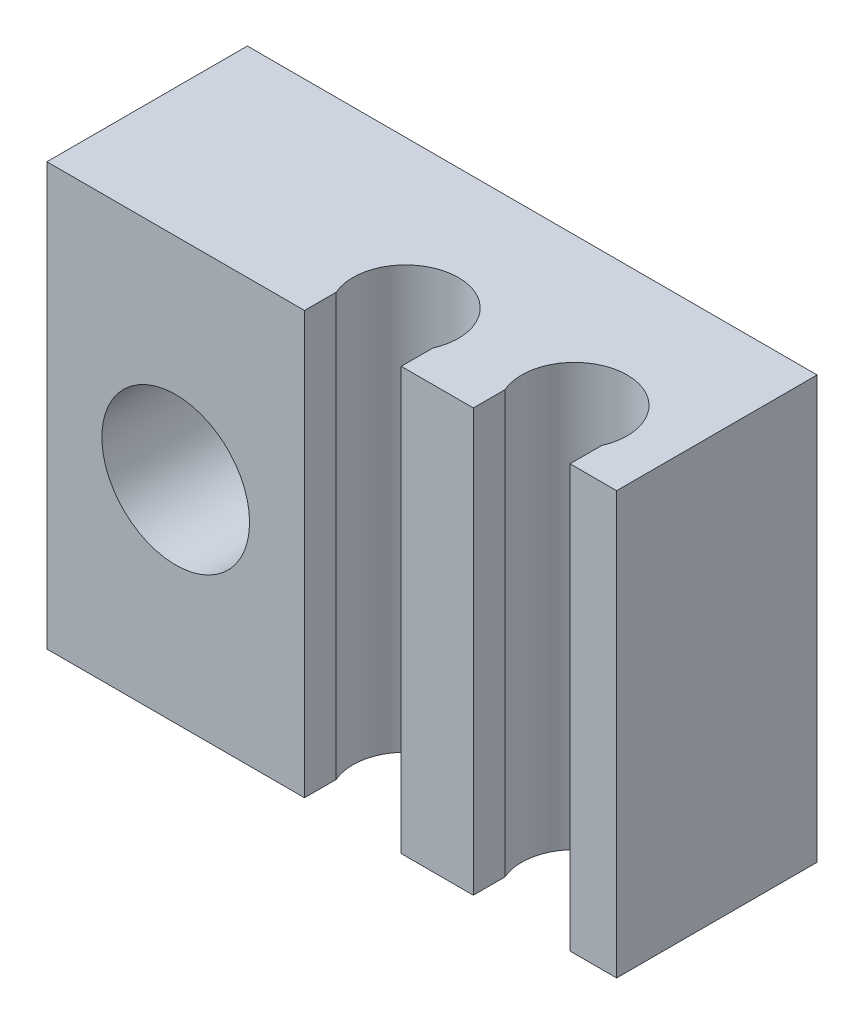
from build123d import *

# Parameters (mm, degrees)
BOSS_EXTRUDE1_DEPTH = 10
SKETCH4_R           = 1.75
CUT_EXTRUDE2_DEPTH  = 14.957524852


with BuildPart() as part:
    # Sketch1 → Boss-Extrude1 (new body)
    with BuildSketch(Plane(origin=(0, 0, 0), x_dir=(1, 0, 0), z_dir=(0, 1, 0))):
        with BuildLine():
            Line((8.5, 4), (-5, 4))
            Line((-5, 4), (-5, -0.75))
            Line((-5, -0.75), (1.104356076, -0.75))
            Line((1.104356076, -0.75), (1.104356076, 0))
            ThreePointArc((1.104356076, 0), (2.25, 1.75), (3.395643924, 0))
            Line((3.395643924, 0), (3.395643924, -0.75))
            Line((3.395643924, -0.75), (5.104356076, -0.75))
            Line((5.104356076, -0.75), (5.104356076, 0))
            ThreePointArc((5.104356076, 0), (6.25, 1.75), (7.395643924, 0))
            Line((7.395643924, 0), (7.395643924, -0.75))
            Line((7.395643924, -0.75), (8.5, -0.75))
            Line((8.5, -0.75), (8.5, 4))
        make_face()
    extrude(amount=BOSS_EXTRUDE1_DEPTH)

    # Sketch4 → Cut-Extrude2 (cut, through all)
    with BuildSketch(Plane.XY.offset(0.75)):
        with Locations((-1.947821962, 5)):
            Circle(SKETCH4_R)
    extrude(amount=-CUT_EXTRUDE2_DEPTH, mode=Mode.SUBTRACT)


solid = part.part
